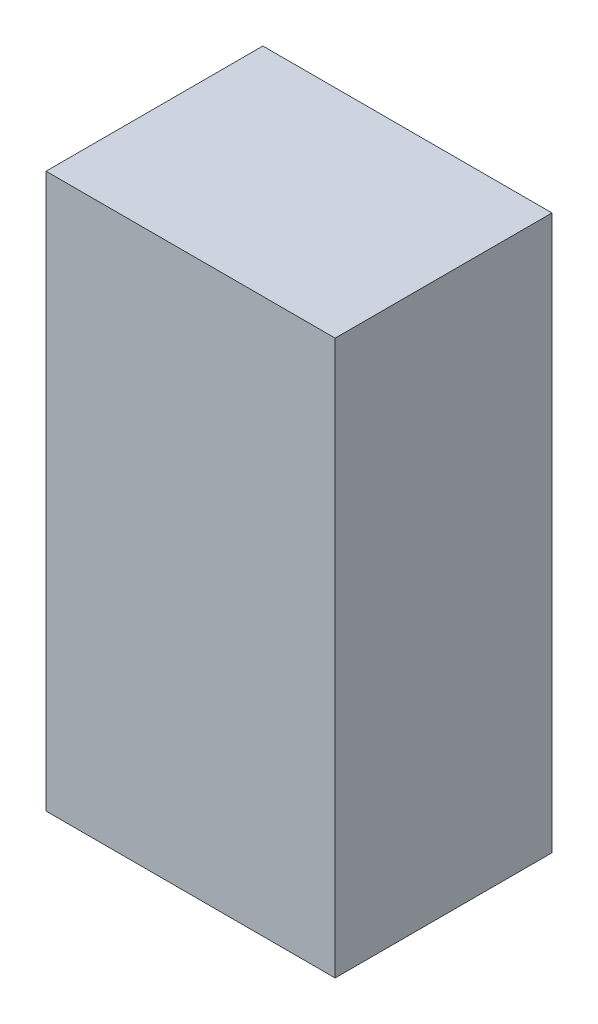
from build123d import *

# Parameters (mm, degrees)
SKETCH1_W           = 60
SKETCH1_H           = 115
BOSS_EXTRUDE1_DEPTH = 45


with BuildPart() as part:
    # Sketch1 → Boss-Extrude1 (new body)
    with BuildSketch(Plane.XY):
        Rectangle(SKETCH1_W, SKETCH1_H)
    extrude(amount=BOSS_EXTRUDE1_DEPTH)


solid = part.part
